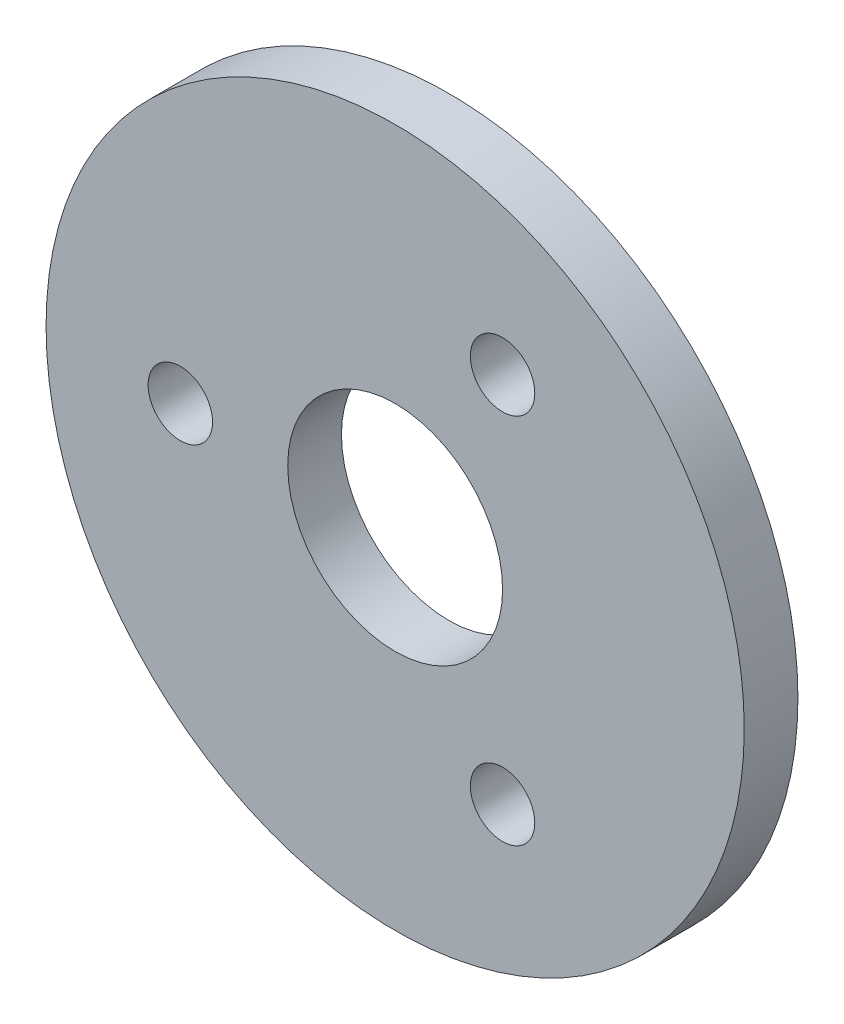
from build123d import *

# Parameters (mm, degrees)
SKETCH1_R           = 32.5
SKETCH1_R_2         = 10
SKETCH1_R_3         = 3
BOSS_EXTRUDE1_DEPTH = 2.5


with BuildPart() as part:
    # Sketch1 → Boss-Extrude1 (new, symmetric)
    with BuildSketch(Plane(origin=(0, 0, 0), x_dir=(0, 1, 0), z_dir=(0, 0, 1))):
        with Locations(Location((0, 0, 0), (0, 0, 270))):
            Circle(SKETCH1_R)
        with Locations(Location((0, 0, 0), (0, 0, 270))):
            Circle(SKETCH1_R_2, mode=Mode.SUBTRACT)
        with Locations(Location((0, 20, 0), (0, 0, 270))):
            Circle(SKETCH1_R_3, mode=Mode.SUBTRACT)
        with Locations(Location((17.320508076, -10, 0), (0, 0, 270))):
            Circle(SKETCH1_R_3, mode=Mode.SUBTRACT)
        with Locations(Location((-17.320508076, -10, 0), (0, 0, 270))):
            Circle(SKETCH1_R_3, mode=Mode.SUBTRACT)
    extrude(amount=BOSS_EXTRUDE1_DEPTH, both=True)


solid = part.part
